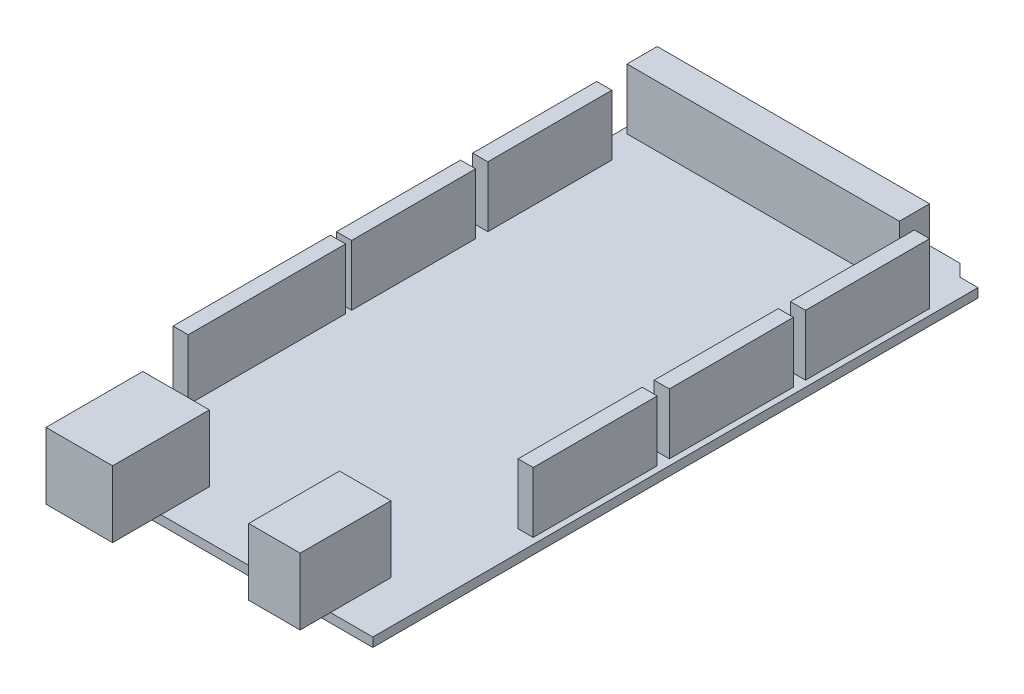
from build123d import *

# Parameters (mm, degrees)
BOSS_EXTRUDE1_DEPTH = 1.5
SKETCH2_W           = 45
SKETCH2_H           = 5
SKETCH2_W_2         = 2.5
SKETCH2_H_2         = 20.5
SKETCH2_H_3         = 26
BOSS_EXTRUDE2_DEPTH = 10
SKETCH3_W           = 8.5
SKETCH3_H           = 15
BOSS_EXTRUDE3_DEPTH = 11
SKETCH4_W           = 11
SKETCH4_H           = 16
BOSS_EXTRUDE4_DEPTH = 11


with BuildPart() as part:
    # Sketch1 → Boss-Extrude1 (new body)
    with BuildSketch(Plane(origin=(0, 0, 0), x_dir=(1, 0, 0), z_dir=(0, 1, 0))):
        Polygon((-26, 48.5), (-14, 48.5), (-11, 52), (21, 52), (23, 50), (26, 50), (26, -50), (-26, -50), align=None)
    extrude(amount=BOSS_EXTRUDE1_DEPTH)

    # Sketch2 → Boss-Extrude2 (add)
    with BuildSketch(Plane(origin=(0, 1.5, 0), x_dir=(1, 0, 0), z_dir=(0, 1, 0))):
        with Locations((-2.5, 45.5)):
            Rectangle(SKETCH2_W, SKETCH2_H)
        with Locations((-23.75, 27.75)):
            Rectangle(SKETCH2_W_2, SKETCH2_H_2)
        with Locations((-23.75, 5.25)):
            Rectangle(SKETCH2_W_2, SKETCH2_H_2)
        with Locations((-23.75, -19)):
            Rectangle(SKETCH2_W_2, SKETCH2_H_3)
        with Locations((23.75, 10.25)):
            Rectangle(SKETCH2_W_2, SKETCH2_H_2)
        with Locations((23.75, 32.75)):
            Rectangle(SKETCH2_W_2, SKETCH2_H_2)
        with Locations((23.75, -12.25)):
            Rectangle(SKETCH2_W_2, SKETCH2_H_2)
    extrude(amount=BOSS_EXTRUDE2_DEPTH)

    # Sketch3 → Boss-Extrude3 (add)
    with BuildSketch(Plane(origin=(0, 1.5, 0), x_dir=(1, 0, 0), z_dir=(0, 1, 0))):
        with Locations((14.75, -47.5)):
            Rectangle(SKETCH3_W, SKETCH3_H)
    extrude(amount=BOSS_EXTRUDE3_DEPTH)

    # Sketch4 → Boss-Extrude4 (add)
    with BuildSketch(Plane(origin=(0, 1.5, 0), x_dir=(1, 0, 0), z_dir=(0, 1, 0))):
        with Locations((-14.5, -50)):
            Rectangle(SKETCH4_W, SKETCH4_H)
    extrude(amount=BOSS_EXTRUDE4_DEPTH)


solid = part.part
